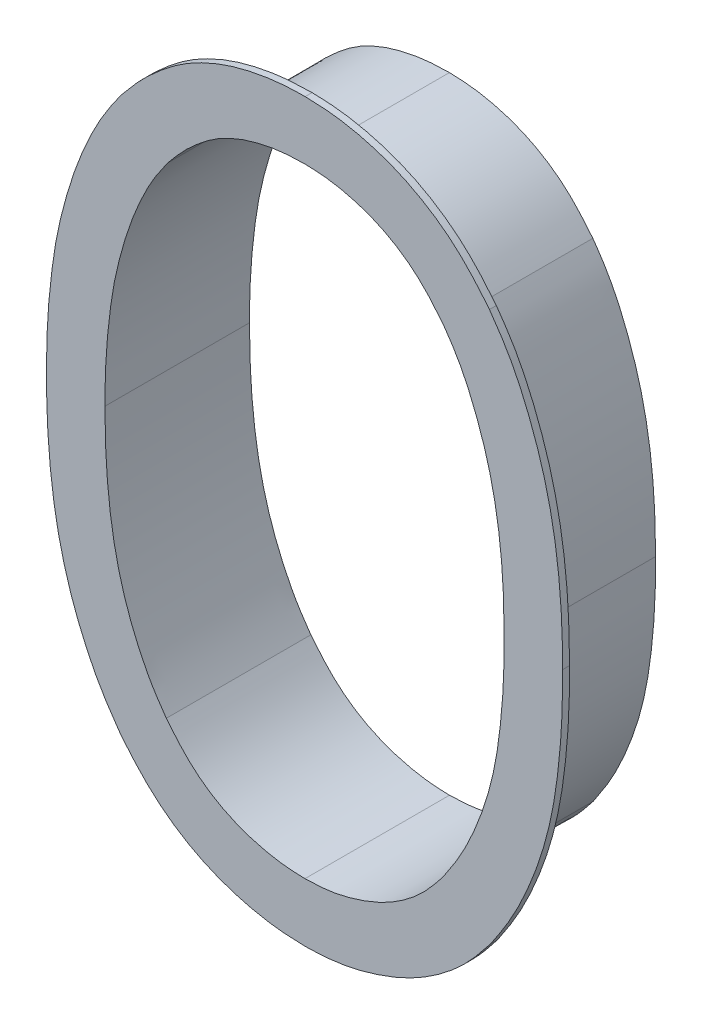
from build123d import *

# Parameters (mm, degrees)
BOSS_EXTRUDE1_DEPTH      = 1
BOSS_EXTRUDE1_DEPTH_BACK = 20
CUT_EXTRUDE1_DEPTH       = 108.424377703
CUT_EXTRUDE2_DEPTH       = 20


with BuildPart() as part:
    # Sketch1 → Boss-Extrude1 (new, two sides: drawn at the far end of the back side and taken through both)
    with BuildSketch(Plane.XY.offset(-BOSS_EXTRUDE1_DEPTH_BACK)):
        with BuildLine():
            add(Edge.make_bspline(
                [(2867.550981787, -1534.018284524), (2866.726669934, -1533.016673289), (2865.903331775, -1532.0139593), (2864.168194025, -1530.108718015), (2863.257736558, -1529.2046707), (2861.320445794, -1527.52837712), (2860.291663886, -1526.758337746), (2858.669123788, -1525.693165779), (2858.115518951, -1525.352557641), (2856.982492704, -1524.700579838), (2856.403299251, -1524.389960753), (2853.487637686, -1522.941890219), (2851.052549882, -1522.104118603), (2847.906668653, -1521.375909526), (2847.272631369, -1521.245467432), (2845.99309967, -1521.020407923), (2845.346335825, -1520.925682909), (2844.044824104, -1520.779866571), (2843.392534449, -1520.730980323), (2842.086182938, -1520.660963629), (2841.432122831, -1520.639805771), (2840.778087094, -1520.618266243)],
                knots=[0, 0, 0, 0, 0.125, 0.125, 0.25, 0.25, 0.375, 0.375, 0.4375, 0.4375, 0.5, 0.5, 0.75, 0.75, 0.8125, 0.8125, 0.875, 0.875, 0.9375, 0.9375, 1, 1, 1, 1], degree=3))
            add(Edge.make_bspline(
                [(2840.778087094, -1520.618266243), (2839.482255968, -1520.645951624), (2838.1868012, -1520.675671132), (2835.629535588, -1520.916947524), (2834.366177794, -1521.120143515), (2831.861063883, -1521.643287414), (2830.619943166, -1521.966669503), (2828.170088197, -1522.788474802), (2826.95328033, -1523.287217046), (2824.623840035, -1524.417062084), (2823.50672353, -1525.055881742), (2821.383367513, -1526.505640089), (2820.373008789, -1527.310184348), (2818.897915882, -1528.579785494), (2818.413289391, -1529.015858292), (2817.472469362, -1529.911705886), (2817.01588517, -1530.372439334), (2815.689411795, -1531.79473794), (2814.862667017, -1532.796276469), (2814.034988655, -1533.796950032)],
                knots=[0, 0, 0, 0, 0.125, 0.125, 0.25, 0.25, 0.375, 0.375, 0.5, 0.5, 0.625, 0.625, 0.75, 0.75, 0.8125, 0.8125, 0.875, 0.875, 1, 1, 1, 1], degree=3))
            add(Edge.make_bspline(
                [(2814.034988655, -1533.796950032), (2813.520317325, -1534.522913295), (2813.004467704, -1535.248303696), (2812.017261221, -1536.720716027), (2811.548505014, -1537.469002346), (2810.672548186, -1538.995502136), (2810.264314938, -1539.773213563), (2809.488458401, -1541.348380203), (2809.119773324, -1542.145319195), (2808.417709692, -1543.756362535), (2808.084791575, -1544.570690741), (2807.457495675, -1546.218084726), (2807.16353084, -1547.051351273), (2806.609611695, -1548.734419635), (2806.349191719, -1549.585413693), (2805.857967435, -1551.293364665), (2805.626529307, -1552.150248424), (2805.19794891, -1553.871052884), (2805.000864278, -1554.734985411), (2804.64686161, -1556.471091984), (2804.490654329, -1557.343411866), (2804.211504213, -1559.094876943), (2804.088491516, -1559.974007803), (2803.86600941, -1561.737100217), (2803.765506417, -1562.620719903), (2803.498062361, -1565.271902691), (2803.368970865, -1567.04215703), (2803.22037608, -1570.588899959), (2803.196358835, -1572.365131759), (2803.171798599, -1574.14133267)],
                knots=[0, 0, 0, 0, 0.0625, 0.0625, 0.125, 0.125, 0.1875, 0.1875, 0.25, 0.25, 0.3125, 0.3125, 0.375, 0.375, 0.4375, 0.4375, 0.5, 0.5, 0.5625, 0.5625, 0.625, 0.625, 0.6875, 0.6875, 0.75, 0.75, 0.875, 0.875, 1, 1, 1, 1], degree=3))
            add(Edge.make_bspline(
                [(2803.171798599, -1574.14133267), (2803.197934131, -1575.899407851), (2803.223572787, -1577.65750617), (2803.357597853, -1581.169849407), (2803.469175861, -1582.923945698), (2803.793967227, -1586.427405318), (2804.003018201, -1588.173719502), (2804.539970007, -1591.643522555), (2804.871311526, -1593.367599376), (2805.482598261, -1595.934037916), (2805.705297725, -1596.787500719), (2806.186026682, -1598.475210537), (2806.444191453, -1599.310810006), (2807.274630372, -1601.791662365), (2807.903846315, -1603.410506726), (2808.955506963, -1605.788760629), (2809.323084957, -1606.573616314), (2810.0953485, -1608.126117903), (2810.501002081, -1608.893314851), (2811.367913517, -1610.401920536), (2811.830399625, -1611.142759633), (2812.799615219, -1612.603918584), (2813.30425055, -1613.325209668), (2813.807793783, -1614.047007246)],
                knots=[0, 0, 0, 0, 0.125, 0.125, 0.25, 0.25, 0.375, 0.375, 0.5, 0.5, 0.5625, 0.5625, 0.625, 0.625, 0.75, 0.75, 0.8125, 0.8125, 0.875, 0.875, 0.9375, 0.9375, 1, 1, 1, 1], degree=3))
            add(Edge.make_bspline(
                [(2813.807793783, -1614.047007246), (2814.630107586, -1615.060598361), (2815.451797544, -1616.074881166), (2817.193311878, -1617.994639735), (2818.111859469, -1618.901531141), (2820.057855984, -1620.594569036), (2821.085444677, -1621.380560556), (2822.713994838, -1622.462900841), (2823.271513745, -1622.807416769), (2824.416380943, -1623.463375142), (2824.997804789, -1623.771457012), (2827.93317208, -1625.211940528), (2830.384739981, -1626.057858686), (2833.558170713, -1626.791882356), (2834.198241918, -1626.92270678), (2835.490692674, -1627.147830269), (2836.144438676, -1627.242055541), (2838.106631395, -1627.458474363), (2839.422001459, -1627.503974116), (2840.737467236, -1627.548168289)],
                knots=[0, 0, 0, 0, 0.125, 0.125, 0.25, 0.25, 0.375, 0.375, 0.4375, 0.4375, 0.5, 0.5, 0.75, 0.75, 0.8125, 0.8125, 0.875, 0.875, 1, 1, 1, 1], degree=3))
            add(Edge.make_bspline(
                [(2840.737467236, -1627.548168289), (2842.053831936, -1627.505174832), (2843.369874247, -1627.460476657), (2845.965273107, -1627.177093927), (2847.246722599, -1626.94947641), (2849.779317361, -1626.333999207), (2851.030643196, -1625.94709431), (2852.891082107, -1625.279224985), (2853.509056231, -1625.04019579), (2854.721073405, -1624.528538908), (2855.316771428, -1624.255167215), (2857.06986008, -1623.377192491), (2858.194948661, -1622.717628071), (2859.823640933, -1621.627994999), (2860.356496438, -1621.247697818), (2861.400636286, -1620.450400488), (2861.913480342, -1620.032005189), (2863.405008085, -1618.728971089), (2864.334686324, -1617.800593701), (2866.080306192, -1615.838870115), (2866.894028662, -1614.803475831), (2867.70846268, -1613.768738243)],
                knots=[0, 0, 0, 0, 0.125, 0.125, 0.25, 0.25, 0.375, 0.375, 0.4375, 0.4375, 0.5, 0.5, 0.625, 0.625, 0.6875, 0.6875, 0.75, 0.75, 0.875, 0.875, 1, 1, 1, 1], degree=3))
            add(Edge.make_bspline(
                [(2867.70846268, -1613.768738243), (2868.19603201, -1613.042916084), (2868.684608264, -1612.317570902), (2869.630535197, -1610.852089056), (2870.08657658, -1610.111332181), (2871.380286345, -1607.85381163), (2872.151008848, -1606.305335844), (2873.551584263, -1603.141654667), (2874.181498961, -1601.526478544), (2875.020043732, -1599.053347371), (2875.281521558, -1598.220426181), (2875.766103566, -1596.536406293), (2875.988460291, -1595.688586801), (2876.593986087, -1593.136972092), (2876.91327239, -1591.420591919), (2877.296991004, -1588.828757202), (2877.409250484, -1587.961975095), (2877.612246279, -1586.224508116), (2877.703460689, -1585.353503518), (2877.942170175, -1582.73991052), (2878.051704983, -1580.995234174), (2878.169545277, -1577.501226585), (2878.183829611, -1575.75217027), (2878.198200329, -1574.003117928)],
                knots=[0, 0, 0, 0, 0.0625, 0.0625, 0.125, 0.125, 0.25, 0.25, 0.375, 0.375, 0.4375, 0.4375, 0.5, 0.5, 0.625, 0.625, 0.6875, 0.6875, 0.75, 0.75, 0.875, 0.875, 1, 1, 1, 1], degree=3))
            add(Edge.make_bspline(
                [(2878.198200329, -1574.003117928), (2878.170715802, -1572.244237268), (2878.143547605, -1570.485341057), (2878.003838155, -1566.971745669), (2877.888768483, -1565.217170791), (2877.550156687, -1561.71335366), (2877.329355407, -1559.967208823), (2876.765535621, -1556.500208882), (2876.42251932, -1554.777786009), (2875.801117381, -1552.213525973), (2875.575568387, -1551.36054037), (2875.088850149, -1549.672231532), (2874.827850731, -1548.836195784), (2873.996945227, -1546.350137102), (2873.383410059, -1544.720193768), (2872.362745994, -1542.32146849), (2872.005403179, -1541.529773281), (2871.248665231, -1539.965736783), (2870.848899607, -1539.193566007), (2869.989667524, -1537.676700828), (2869.529224121, -1536.932456049), (2868.560883456, -1535.465806386), (2868.055278555, -1534.742346479), (2867.550981787, -1534.018284524)],
                knots=[0, 0, 0, 0, 0.125, 0.125, 0.25, 0.25, 0.375, 0.375, 0.5, 0.5, 0.5625, 0.5625, 0.625, 0.625, 0.75, 0.75, 0.8125, 0.8125, 0.875, 0.875, 0.9375, 0.9375, 1, 1, 1, 1], degree=3))
        make_face()
        with BuildLine():
            add(Edge.make_bspline(
                [(2859.574553128, -1540.062940936), (2858.993973603, -1539.35769697), (2858.412814815, -1538.653082859), (2857.199664795, -1537.299126654), (2856.565713378, -1536.651915944), (2855.209563162, -1535.453449205), (2854.482953317, -1534.906989471), (2853.333000755, -1534.15258121), (2852.938780538, -1533.91053846), (2852.138617279, -1533.451303508), (2851.733896878, -1533.235081312), (2849.685902634, -1532.224407254), (2847.967033012, -1531.648251657), (2845.744514013, -1531.141548888), (2845.296503127, -1531.05033567), (2844.391641825, -1530.893434948), (2843.934059007, -1530.827605141), (2842.560890903, -1530.681935091), (2841.640541252, -1530.652266412), (2840.720250162, -1530.621792388)],
                knots=[0, 0, 0, 0, 0.125, 0.125, 0.25, 0.25, 0.375, 0.375, 0.4375, 0.4375, 0.5, 0.5, 0.75, 0.75, 0.8125, 0.8125, 0.875, 0.875, 1, 1, 1, 1], degree=3))
            add(Edge.make_bspline(
                [(2840.720250162, -1530.621792388), (2839.810255808, -1530.641382444), (2838.900203622, -1530.660673023), (2837.10258928, -1530.815718028), (2836.215837572, -1530.955669325), (2834.457082641, -1531.311946452), (2833.585089034, -1531.528322067), (2832.295639861, -1531.948900657), (2831.868898935, -1532.105019705), (2831.021207461, -1532.447243081), (2830.599030673, -1532.634113507), (2829.775360222, -1533.031703953), (2829.372546183, -1533.24353081), (2828.589799786, -1533.700238459), (2828.210645346, -1533.946242997), (2827.473647464, -1534.469037065), (2827.115016725, -1534.744689296), (2826.40916489, -1535.31247566), (2826.061836005, -1535.604454084), (2825.377157185, -1536.202826112), (2825.039766011, -1536.510623027), (2824.383065021, -1537.145269228), (2824.064922977, -1537.471814456), (2823.140810811, -1538.478835222), (2822.559117296, -1539.181241801), (2821.977732858, -1539.883927596)],
                knots=[0, 0, 0, 0, 0.125, 0.125, 0.25, 0.25, 0.375, 0.375, 0.4375, 0.4375, 0.5, 0.5, 0.5625, 0.5625, 0.625, 0.625, 0.6875, 0.6875, 0.75, 0.75, 0.8125, 0.8125, 0.875, 0.875, 1, 1, 1, 1], degree=3))
            add(Edge.make_bspline(
                [(2821.977732858, -1539.883927596), (2821.541843818, -1540.498918683), (2821.10622274, -1541.114038435), (2820.279054967, -1542.365440741), (2819.891380357, -1543.003582519), (2819.175801033, -1544.30856525), (2818.84354984, -1544.973319194), (2818.209036872, -1546.31722683), (2817.907465724, -1546.996712135), (2817.336287893, -1548.371030837), (2817.067105022, -1549.066067731), (2816.562474739, -1550.472339971), (2816.326437263, -1551.183291992), (2815.880474184, -1552.617733938), (2815.670350573, -1553.340649048), (2815.274082236, -1554.789032707), (2815.088547339, -1555.515772098), (2814.748569104, -1556.975537566), (2814.594506125, -1557.70864055), (2814.321649462, -1559.18197794), (2814.081780196, -1560.661985352), (2813.890164814, -1562.151749656), (2813.714163149, -1563.64467104), (2813.634352563, -1564.391967369), (2813.424587113, -1566.634947671), (2813.325965852, -1568.1325335), (2813.214449312, -1571.132416753), (2813.193601034, -1572.634277072), (2813.172826438, -1574.136141441)],
                knots=[0, 0, 0, 0, 0.0625, 0.0625, 0.125, 0.125, 0.1875, 0.1875, 0.25, 0.25, 0.3125, 0.3125, 0.375, 0.375, 0.4375, 0.4375, 0.5, 0.5, 0.5625, 0.5625, 0.625, 0.6875, 0.6875, 0.75, 0.75, 0.875, 0.875, 1, 1, 1, 1], degree=3))
            add(Edge.make_bspline(
                [(2813.172826438, -1574.136141441), (2813.194932222, -1575.622756268), (2813.217146935, -1577.109365501), (2813.317988434, -1580.079686736), (2813.401469918, -1581.563149409), (2813.650895469, -1584.525839614), (2813.813436549, -1586.006816649), (2814.228177418, -1588.94948324), (2814.482889481, -1590.411981264), (2814.960157592, -1592.587961318), (2815.134954256, -1593.310356583), (2815.516908322, -1594.749107695), (2815.724129635, -1595.46490305), (2816.39214344, -1597.585935451), (2816.902703092, -1598.969239288), (2817.765120387, -1600.998706148), (2818.06810101, -1601.667890624), (2818.704069095, -1602.992126124), (2819.036900528, -1603.647250638), (2819.750693048, -1604.93483023), (2820.135709718, -1605.565375096), (2820.949706714, -1606.805757607), (2821.375612616, -1607.41704333), (2821.801858867, -1608.028168746)],
                knots=[0, 0, 0, 0, 0.125, 0.125, 0.25, 0.25, 0.375, 0.375, 0.5, 0.5, 0.5625, 0.5625, 0.625, 0.625, 0.75, 0.75, 0.8125, 0.8125, 0.875, 0.875, 0.9375, 0.9375, 1, 1, 1, 1], degree=3))
            add(Edge.make_bspline(
                [(2821.801858867, -1608.028168746), (2822.380015859, -1608.740599488), (2822.958626366, -1609.452524843), (2824.171563392, -1610.814287142), (2824.809658751, -1611.45992419), (2826.164545462, -1612.663501604), (2826.881620149, -1613.221126228), (2828.021919007, -1613.985477917), (2828.41292353, -1614.228109683), (2829.21696937, -1614.68881601), (2829.629955809, -1614.906766856), (2831.707857118, -1615.919148107), (2833.441791601, -1616.504714795), (2835.679191962, -1617.017444714), (2836.130139727, -1617.109127704), (2837.040279431, -1617.266667747), (2837.500833335, -1617.332601713), (2838.886112708, -1617.480271737), (2839.814121108, -1617.5112819), (2840.742104447, -1617.542668551)],
                knots=[0, 0, 0, 0, 0.125, 0.125, 0.25, 0.25, 0.375, 0.375, 0.4375, 0.4375, 0.5, 0.5, 0.75, 0.75, 0.8125, 0.8125, 0.875, 0.875, 1, 1, 1, 1], degree=3))
            add(Edge.make_bspline(
                [(2840.742104447, -1617.542668551), (2841.665163478, -1617.512286254), (2842.588221518, -1617.48189938), (2844.406368353, -1617.291971524), (2845.301490569, -1617.132584866), (2847.067206857, -1616.700547482), (2847.938127548, -1616.429404989), (2849.232863902, -1615.968919378), (2849.662345426, -1615.805739611), (2850.515413843, -1615.452160334), (2850.939729401, -1615.260972241), (2852.179240699, -1614.646559377), (2852.969268023, -1614.182658688), (2854.489094792, -1613.164811044), (2855.217685933, -1612.609057563), (2856.255355411, -1611.692872455), (2856.593055696, -1611.373199985), (2857.244583555, -1610.71523313), (2857.559034121, -1610.376369017), (2858.472358241, -1609.333551667), (2859.045151851, -1608.606821143), (2859.617590162, -1607.879780313)],
                knots=[0, 0, 0, 0, 0.125, 0.125, 0.25, 0.25, 0.375, 0.375, 0.4375, 0.4375, 0.5, 0.5, 0.625, 0.625, 0.75, 0.75, 0.8125, 0.8125, 0.875, 0.875, 1, 1, 1, 1], degree=3))
            add(Edge.make_bspline(
                [(2859.617590162, -1607.879780313), (2860.032108516, -1607.262609766), (2860.446226134, -1606.645220076), (2861.247207391, -1605.395536852), (2861.632448464, -1604.762356017), (2862.718960047, -1602.824965113), (2863.363261718, -1601.489601622), (2864.240659829, -1599.437856968), (2864.517678934, -1598.745519498), (2865.036627429, -1597.355971153), (2865.279460431, -1596.657351352), (2865.95680084, -1594.549669697), (2866.338635169, -1593.128435612), (2866.963411105, -1590.253870692), (2867.205988505, -1588.800455694), (2867.500889971, -1586.604396145), (2867.588455367, -1585.86989552), (2867.748218894, -1584.397343047), (2867.819777122, -1583.658780185), (2867.943429043, -1582.181759494), (2867.995698388, -1581.442845716), (2868.078076069, -1579.964082636), (2868.108042819, -1579.224227356), (2868.173164379, -1577.003615487), (2868.185378838, -1575.521890472), (2868.197558346, -1574.040163982)],
                knots=[0, 0, 0, 0, 0.0625, 0.0625, 0.125, 0.125, 0.25, 0.25, 0.3125, 0.3125, 0.375, 0.375, 0.5, 0.5, 0.625, 0.625, 0.6875, 0.6875, 0.75, 0.75, 0.8125, 0.8125, 0.875, 0.875, 1, 1, 1, 1], degree=3))
            add(Edge.make_bspline(
                [(2868.197558346, -1574.040163982), (2868.174311517, -1572.55277636), (2868.151009075, -1571.065391754), (2868.046140063, -1568.093783839), (2867.960127934, -1566.609801736), (2867.700732914, -1563.646578094), (2867.529713551, -1562.165260019), (2867.091203073, -1559.224105494), (2866.823211889, -1557.763134341), (2866.334438851, -1555.588783635), (2866.157036899, -1554.866853678), (2865.770187357, -1553.429310126), (2865.560098603, -1552.713298121), (2864.887689844, -1550.588955681), (2864.38578241, -1549.197691754), (2863.554190509, -1547.147441072), (2863.262978423, -1546.470547358), (2862.646713212, -1545.132511232), (2862.322049888, -1544.471187388), (2861.620798969, -1543.172707841), (2861.239858649, -1542.537578113), (2860.428647167, -1541.290279686), (2860.001785165, -1540.676524195), (2859.574553128, -1540.062940936)],
                knots=[0, 0, 0, 0, 0.125, 0.125, 0.25, 0.25, 0.375, 0.375, 0.5, 0.5, 0.5625, 0.5625, 0.625, 0.625, 0.75, 0.75, 0.8125, 0.8125, 0.875, 0.875, 0.9375, 0.9375, 1, 1, 1, 1], degree=3))
        make_face(mode=Mode.SUBTRACT)
    extrude(amount=BOSS_EXTRUDE1_DEPTH + BOSS_EXTRUDE1_DEPTH_BACK)

    # 3DSketch1 → Cut-Extrude1 (cut, through all)
    with BuildSketch(Plane(origin=(2840.741406949, -1619.043473492, 1), x_dir=(-0.0461916012688002, 0.9989325983129314, 0), z_dir=(0, 0, -1))):
        with BuildLine():
            add(Edge.make_bspline(
                [(0, -5e-09), (-0.001345106, 0.10190014), (-0.002657074, 0.203801036), (-0.003915915, 0.305703135), (-0.008368011, 0.688326224), (-0.011507472, 1.070979031), (-0.012205821, 1.351728705), (-0.007788088, 2.038844699), (0.017006197, 2.725922427), (0.039910499, 3.131891147), (0.107873315, 3.985635097), (0.222301119, 4.83451917), (0.294270941, 5.278850982), (0.473363235, 6.235124708), (0.698800126, 7.181159521), (0.832132158, 7.686567229), (1.138565292, 8.753342361), (1.489258441, 9.807007), (1.689466575, 10.359114555), (2.119607524, 11.438838675), (2.625568461, 12.485581429), (2.893243748, 12.995362465), (3.426328748, 13.937556921), (4.010813739, 14.848435331), (4.295894627, 15.267134464), (4.855230254, 16.040213538), (5.457100954, 16.780449838), (5.74851989, 17.120459113), (6.330365256, 17.765343428), (6.942625044, 18.381028413), (7.245280153, 18.673353694), (7.768120952, 19.161657527), (8.301742545, 19.637679645), (8.522843857, 19.832186427), (8.819470967, 20.090818872), (9.116758651, 20.348686768), (9.191628069, 20.413561047), (9.266522396, 20.478406498), (9.341433154, 20.54323293)],
                knots=[0, 0, 0, 0, 0, 0, 0.021728615, 0.021728615, 0.021728615, 0.08158551, 0.08158551, 0.08158551, 0.16822379, 0.16822379, 0.16822379, 0.264114247, 0.264114247, 0.264114247, 0.3754856, 0.3754856, 0.3754856, 0.500556438, 0.500556438, 0.500556438, 0.623143203, 0.623143203, 0.623143203, 0.73101359, 0.73101359, 0.73101359, 0.826417036, 0.826417036, 0.826417036, 0.916090355, 0.916090355, 0.916090355, 0.97887748, 0.97887748, 0.97887748, 1, 1, 1, 1, 1, 1], degree=5))
            add(Edge.make_bspline(
                [(9.341433154, 20.54323293), (9.494398294, 20.656520364), (9.647408568, 20.769751153), (9.800508674, 20.882869194), (10.336897919, 21.278241486), (10.875483322, 21.6708574), (11.262443514, 21.948182384), (12.238100316, 22.629276947), (13.241682793, 23.269290821), (13.852820276, 23.639059115), (15.07630468, 24.342800993), (16.327187504, 24.995596144), (16.95113513, 25.306132267), (18.223922616, 25.911056413), (19.516825124, 26.471648451), (20.175290455, 26.743320666), (21.501060201, 27.262305587), (22.845291914, 27.731798114), (23.521358654, 27.953754818), (24.8971269, 28.376531973), (26.288319454, 28.745078743), (26.995155321, 28.918435774), (28.432372999, 29.244957417), (29.878890006, 29.525294094), (30.613086367, 29.657111529), (32.097451434, 29.906216002), (33.586022202, 30.12838231), (34.337903222, 30.232768389), (35.865096218, 30.427274644), (37.396742401, 30.583501657), (38.17414141, 30.653819038), (39.475811377, 30.758189401), (40.778696378, 30.84303498), (41.302929774, 30.874795476), (42.081556052, 30.919615928), (42.860272002, 30.962698523), (43.11460814, 30.976641212), (43.368947937, 30.990513002), (43.623288438, 31.004371129)],
                knots=[0, 0, 0, 0, 0, 0, 0.026101593, 0.026101593, 0.026101593, 0.091367159, 0.091367159, 0.091367159, 0.18924439, 0.18924439, 0.18924439, 0.28477456, 0.28477456, 0.28477456, 0.382410698, 0.382410698, 0.382410698, 0.479936748, 0.479936748, 0.479936748, 0.579690493, 0.579690493, 0.579690493, 0.681959479, 0.681959479, 0.681959479, 0.786036494, 0.786036494, 0.786036494, 0.893054132, 0.893054132, 0.893054132, 0.965071356, 0.965071356, 0.965071356, 1, 1, 1, 1, 1, 1], degree=5))
            add(Edge.make_bspline(
                [(43.623288438, 31.004371129), (43.940947488, 31.014086529), (44.258607375, 31.023781173), (44.576272369, 31.033346558), (45.551355437, 31.061977163), (46.526567375, 31.087345472), (47.184128545, 31.101605809), (48.822723962, 31.12666406), (50.461813853, 31.117180739), (51.442943406, 31.098094429), (53.365705963, 31.032365238), (55.285628919, 30.907176822), (56.225253096, 30.830892668), (57.984051369, 30.65860228), (59.736560695, 30.429044775), (60.552359755, 30.308532893), (62.062273486, 30.058202067), (63.562384096, 29.755180797), (64.251987828, 29.604180383), (65.529164693, 29.302557948), (66.796473381, 28.962012562), (67.379899495, 28.796633832), (68.539948623, 28.451112904), (69.690661636, 28.076007941), (70.262416176, 27.881341787), (71.370368254, 27.487590152), (72.467813328, 27.064619339), (72.998164133, 26.850454323), (74.0598988, 26.398034663), (75.100820006, 25.89847638), (75.619937541, 25.634216465), (76.46947651, 25.175380217), (77.298642782, 24.681520811), (77.625351455, 24.481580868), (78.071243409, 24.204184464), (78.516029909, 23.925201026), (78.636312925, 23.849626555), (78.756551458, 23.773988221), (78.876763728, 23.698312185)],
                knots=[0, 0, 0, 0, 0, 0, 0.043429363, 0.043429363, 0.043429363, 0.133303907, 0.133303907, 0.133303907, 0.267365567, 0.267365567, 0.267365567, 0.396146522, 0.396146522, 0.396146522, 0.508783998, 0.508783998, 0.508783998, 0.605223573, 0.605223573, 0.605223573, 0.688070037, 0.688070037, 0.688070037, 0.770592322, 0.770592322, 0.770592322, 0.848719679, 0.848719679, 0.848719679, 0.92825835, 0.92825835, 0.92825835, 0.980588888, 0.980588888, 0.980588888, 1, 1, 1, 1, 1, 1], degree=5))
            add(Edge.make_bspline(
                [(78.876763728, 23.698312185), (78.952748736, 23.641418158), (79.028721499, 23.584507702), (79.104676313, 23.527573216), (79.419115249, 23.291670526), (79.73305134, 23.055094661), (79.97052381, 22.874781433), (80.539844722, 22.437395339), (81.101148115, 21.989437817), (81.425601401, 21.722931616), (82.079428117, 21.166552734), (82.709435692, 20.582725512), (83.024060571, 20.276711459), (83.676888684, 19.606882873), (84.286875548, 18.897261523), (84.599219644, 18.5106447), (85.240813286, 17.669536831), (85.835849016, 16.795421612), (86.13755568, 16.323027914), (86.720696756, 15.346535317), (87.241856464, 14.335233706), (87.490163399, 13.81407847), (87.930674538, 12.811145624), (88.312371426, 11.784967845), (88.480696692, 11.294994481), (88.775440837, 10.367927087), (89.033377368, 9.430090197), (89.144790876, 8.989384485), (89.337549441, 8.145129802), (89.489040323, 7.292377434), (89.552108874, 6.885578206), (89.643449337, 6.202332245), (89.711993593, 5.516755023), (89.736929997, 5.240299348), (89.769398232, 4.854546725), (89.800636066, 4.468727613), (89.809399351, 4.359556688), (89.818110332, 4.250382937), (89.826792107, 4.141207607)],
                knots=[0, 0, 0, 0, 0, 0, 0.02039408, 0.02039408, 0.02039408, 0.084454016, 0.084454016, 0.084454016, 0.174634038, 0.174634038, 0.174634038, 0.268859216, 0.268859216, 0.268859216, 0.375481837, 0.375481837, 0.375481837, 0.495777603, 0.495777603, 0.495777603, 0.619637421, 0.619637421, 0.619637421, 0.730851138, 0.730851138, 0.730851138, 0.828455315, 0.828455315, 0.828455315, 0.916840879, 0.916840879, 0.916840879, 0.976470271, 0.976470271, 0.976470271, 1, 1, 1, 1, 1, 1], degree=5))
            add(Edge.make_bspline(
                [(89.826792107, 4.141207607), (89.829500311, 4.031203294), (89.832178071, 3.921197768), (89.83480119, 3.811190081), (89.843741022, 3.424645392), (89.851408779, 3.03805042), (89.855359304, 2.761456063), (89.859160078, 2.075008739), (89.842621085, 1.388425775), (89.824807, 0.978766402), (89.769741522, 0.126852584), (89.674264722, -0.721372675), (89.614801166, -1.161172519), (89.468075315, -2.104551974), (89.285845925, -3.042047435), (89.176486106, -3.541136692), (88.920881739, -4.572058783), (88.599354436, -5.584826533), (88.415070031, -6.105014923), (88.010787797, -7.137402748), (87.53965053, -8.141728043), (87.285271134, -8.637268965), (86.765377528, -9.560579405), (86.174440776, -10.439151199), (85.881379017, -10.848061108), (85.304466862, -11.616966169), (84.707535596, -12.369635236), (84.417200968, -12.72316977), (83.84389559, -13.391683246), (83.238166624, -14.031295619), (82.940653823, -14.332918765), (82.431117755, -14.832226321), (81.91052722, -15.319367626), (81.697778972, -15.51573405), (81.412111953, -15.777129138), (81.125813015, -16.037842446), (81.053545944, -16.1035874), (80.981254924, -16.169306516), (80.908948097, -16.235008577)],
                knots=[0, 0, 0, 0, 0, 0, 0.023776889, 0.023776889, 0.023776889, 0.083544799, 0.083544799, 0.083544799, 0.17209543, 0.17209543, 0.17209543, 0.267939707, 0.267939707, 0.267939707, 0.378236477, 0.378236477, 0.378236477, 0.497313658, 0.497313658, 0.497313658, 0.617443893, 0.617443893, 0.617443893, 0.726031371, 0.726031371, 0.726031371, 0.824839182, 0.824839182, 0.824839182, 0.916328504, 0.916328504, 0.916328504, 0.978889166, 0.978889166, 0.978889166, 1, 1, 1, 1, 1, 1], degree=5))
            add(Edge.make_bspline(
                [(80.908948097, -16.235008577), (80.763591797, -16.348415069), (80.618170289, -16.461747405), (80.472620184, -16.574933492), (79.956058849, -16.975330997), (79.436289337, -17.372079973), (79.060020337, -17.652631562), (78.103528492, -18.340449588), (77.108360622, -18.971412554), (76.498179405, -19.333496799), (75.265976273, -20.025356426), (74.010128801, -20.671051305), (73.379229402, -20.980715676), (72.078564154, -21.588792916), (70.754780263, -22.145145617), (70.073660247, -22.416913955), (68.700122468, -22.939176196), (67.312420196, -23.421497973), (66.613796046, -23.652818728), (65.196583516, -24.098482357), (63.76589415, -24.500000753), (63.040616315, -24.690621043), (61.574805359, -25.048519557), (60.096972381, -25.351606479), (59.351142327, -25.492661213), (57.846782295, -25.758476563), (56.338245399, -25.99790015), (55.57820747, -26.110751537), (54.032629891, -26.322590489), (52.482060565, -26.495506267), (51.694105165, -26.573934082), (50.376841204, -26.690502319), (49.058030019, -26.784950677), (48.528718042, -26.820197356), (47.745634442, -26.869765689), (46.962452546, -26.917536517), (46.708754881, -26.932879336), (46.455053176, -26.948148279), (46.201350569, -26.963400707)],
                knots=[0, 0, 0, 0, 0, 0, 0.024958548, 0.024958548, 0.024958548, 0.08846189, 0.08846189, 0.08846189, 0.184420242, 0.184420242, 0.184420242, 0.279533875, 0.279533875, 0.279533875, 0.378768207, 0.378768207, 0.378768207, 0.478375414, 0.478375414, 0.478375414, 0.579853489, 0.579853489, 0.579853489, 0.682586654, 0.682586654, 0.682586654, 0.786597423, 0.786597423, 0.786597423, 0.893775882, 0.893775882, 0.893775882, 0.965591584, 0.965591584, 0.965591584, 1, 1, 1, 1, 1, 1], degree=5))
            add(Edge.make_bspline(
                [(46.201350569, -26.963400707), (45.887501459, -26.973237442), (45.573651362, -26.983051636), (45.259796099, -26.992746555), (44.287060456, -27.02212379), (43.314194688, -27.048497082), (42.655170777, -27.063588865), (41.02016614, -27.090693437), (39.384700882, -27.0835876), (38.408599999, -27.066652945), (36.489794613, -27.007397658), (34.573244261, -26.895151911), (33.632232184, -26.825913707), (31.831937351, -26.663869913), (30.037754286, -26.440832204), (29.182087387, -26.319115741), (27.556720635, -26.05622738), (25.942843049, -25.730080431), (25.179089133, -25.560496608), (23.725313014, -25.207600165), (22.286164604, -24.798775969), (21.603287669, -24.591038598), (20.265010082, -24.156504242), (18.943973964, -23.67283823), (18.297368984, -23.422693068), (17.000877424, -22.893987769), (15.72365677, -22.318141447), (15.085869667, -22.01286246), (14.039189062, -21.476118686), (13.022801163, -20.884522005), (12.62072251, -20.641928948), (12.062107164, -20.297030704), (11.506018788, -19.948563499), (11.347883684, -19.84915689), (11.189850685, -19.749606074), (11.031868471, -19.649983531)],
                knots=[0, 0, 0, 0, 0, 0, 0.042970744, 0.042970744, 0.042970744, 0.133175809, 0.133175809, 0.133175809, 0.266741198, 0.266741198, 0.266741198, 0.395826664, 0.395826664, 0.395826664, 0.514040191, 0.514040191, 0.514040191, 0.621054984, 0.621054984, 0.621054984, 0.718684913, 0.718684913, 0.718684913, 0.813532929, 0.813532929, 0.813532929, 0.910208938, 0.910208938, 0.910208938, 0.974441302, 0.974441302, 0.974441302, 1, 1, 1, 1, 1, 1], degree=5))
            add(Edge.make_bspline(
                [(11.031868471, -19.649983531), (10.950475165, -19.589929604), (10.869095928, -19.529856657), (10.787738487, -19.469754297), (10.469216427, -19.234206597), (10.151265135, -18.997888639), (9.915207105, -18.820953579), (9.345390123, -18.388241975), (8.784396716, -17.943686948), (8.458780993, -17.677398887), (7.800394145, -17.118150646), (7.167725739, -16.529671823), (6.850280996, -16.220018876), (6.191335209, -15.545105609), (5.568951341, -14.835663613), (5.250083289, -14.450342337), (4.595852107, -13.610596114), (3.996851965, -12.730649134), (3.694626137, -12.253769462), (3.113243363, -11.268844258), (2.59397577, -10.250084698), (2.346826432, -9.726325327), (1.905732938, -8.714782146), (1.521262041, -7.680815939), (1.350675203, -7.184940264), (1.052728861, -6.249053777), (0.79288513, -5.30195371), (0.681178258, -4.858126098), (0.488056085, -4.006485981), (0.337350305, -3.146254365), (0.274591954, -2.735180065), (0.183339212, -2.04366211), (0.113844773, -1.349966173), (0.088366017, -1.06955745), (0.05587038, -0.68734479), (0.024608357, -0.305056027), (0.016362034, -0.20337337), (0.008165495, -0.101687643), (0, -5e-09)],
                knots=[0, 0, 0, 0, 0, 0, 0.021604331, 0.021604331, 0.021604331, 0.084613677, 0.084613677, 0.084613677, 0.174417374, 0.174417374, 0.174417374, 0.269072098, 0.269072098, 0.269072098, 0.37574855, 0.37574855, 0.37574855, 0.496166617, 0.496166617, 0.496166617, 0.619715586, 0.619715586, 0.619715586, 0.731627784, 0.731627784, 0.731627784, 0.829317547, 0.829317547, 0.829317547, 0.918078481, 0.918078481, 0.918078481, 0.978211101, 0.978211101, 0.978211101, 1, 1, 1, 1, 1, 1], degree=5))
        make_face()
    extrude(amount=CUT_EXTRUDE1_DEPTH, mode=Mode.SUBTRACT)

    # Sketch2 → Cut-Extrude2 (cut)
    with BuildSketch(Plane(origin=(0, 0, -20), x_dir=(-1, 0, 0), z_dir=(0, 0, -1))):
        with BuildLine():
            add(Edge.make_bspline(
                [(-2868.747447798, -1533.111590253), (-2869.262745246, -1533.851446825), (-2869.779612419, -1534.590550797), (-2870.77071914, -1536.089196419), (-2871.242735031, -1536.849804193), (-2872.125732395, -1538.400282497), (-2872.537169602, -1539.189934525), (-2873.316142432, -1540.790287055), (-2873.684135196, -1541.600768381), (-2874.735358853, -1544.0575054), (-2875.367655547, -1545.728181329), (-2876.224279962, -1548.278218325), (-2876.494076116, -1549.137310337), (-2876.995618825, -1550.866207206), (-2877.226791595, -1551.734620738), (-2877.865573449, -1554.350935363), (-2878.218956678, -1556.109807186), (-2878.800567135, -1559.652871827), (-2879.028830386, -1561.439742968), (-2879.378388782, -1565.019042591), (-2879.497567993, -1566.811730326), (-2879.642483285, -1570.402211429), (-2879.670206043, -1572.199896246), (-2879.698296616, -1573.997560967)],
                knots=[0, 0, 0, 0, 0.0625, 0.0625, 0.125, 0.125, 0.1875, 0.1875, 0.25, 0.25, 0.375, 0.375, 0.4375, 0.4375, 0.5, 0.5, 0.625, 0.625, 0.75, 0.75, 0.875, 0.875, 1, 1, 1, 1], degree=3))
            add(Edge.make_bspline(
                [(-2879.698296616, -1573.997560967), (-2879.68357806, -1575.788948425), (-2879.669086617, -1577.580345131), (-2879.545612984, -1581.159291027), (-2879.431502683, -1582.946631408), (-2879.183868739, -1585.624528303), (-2879.089543504, -1586.515499397), (-2878.879405704, -1588.293844484), (-2878.762938345, -1589.181213402), (-2878.364132177, -1591.835502742), (-2878.031983118, -1593.594541482), (-2877.193344371, -1597.085032323), (-2876.694178139, -1598.798122359), (-2875.548659174, -1602.153883068), (-2874.903765662, -1603.799132419), (-2873.470060025, -1607.024527188), (-2872.680947974, -1608.60453693), (-2871.356249073, -1610.910753952), (-2870.889508304, -1611.668104877), (-2869.921252132, -1613.167075856), (-2869.42105903, -1613.909294074), (-2868.922100522, -1614.65207078)],
                knots=[0, 0, 0, 0, 0.125, 0.125, 0.25, 0.25, 0.3125, 0.3125, 0.375, 0.375, 0.5, 0.5, 0.625, 0.625, 0.75, 0.75, 0.875, 0.875, 0.9375, 0.9375, 1, 1, 1, 1], degree=3))
            add(Edge.make_bspline(
                [(-2868.922100522, -1614.65207078), (-2868.072625307, -1615.731328174), (-2867.22374491, -1616.811237454), (-2865.411687416, -1618.845793514), (-2864.451560119, -1619.803782695), (-2862.412949525, -1621.590049803), (-2861.333673049, -1622.41745845), (-2859.629350136, -1623.564969028), (-2859.047363233, -1623.932261692), (-2857.853201781, -1624.633763123), (-2857.245112873, -1624.965344713), (-2855.403266738, -1625.892573702), (-2854.143888203, -1626.41998131), (-2851.580594499, -1627.346418629), (-2850.279116051, -1627.752472244), (-2848.285551866, -1628.242370362), (-2847.614008341, -1628.385428281), (-2846.255926692, -1628.628321826), (-2845.568062322, -1628.728207832), (-2843.504236165, -1628.956940328), (-2842.120562406, -1629.003795195), (-2840.736766305, -1629.048991012)],
                knots=[0, 0, 0, 0, 0.125, 0.125, 0.25, 0.25, 0.375, 0.375, 0.4375, 0.4375, 0.5, 0.5, 0.625, 0.625, 0.75, 0.75, 0.8125, 0.8125, 0.875, 0.875, 1, 1, 1, 1], degree=3))
            add(Edge.make_bspline(
                [(-2840.736766305, -1629.048991012), (-2839.370533268, -1629.003091271), (-2838.004772911, -1628.955020662), (-2835.316315367, -1628.661103906), (-2833.990835576, -1628.428037382), (-2831.368946824, -1627.828391194), (-2830.072738805, -1627.460888669), (-2828.153381813, -1626.79502428), (-2827.517757121, -1626.553959459), (-2826.255342181, -1626.031255993), (-2825.626112298, -1625.748350858), (-2823.776391858, -1624.847136387), (-2822.592184071, -1624.175172932), (-2820.325367596, -1622.683528713), (-2819.242198904, -1621.864662154), (-2817.175191227, -1620.082511249), (-2816.188482887, -1619.115070874), (-2814.339050151, -1617.084936906), (-2813.474395132, -1616.016914012), (-2812.608679893, -1614.949825912)],
                knots=[0, 0, 0, 0, 0.125, 0.125, 0.25, 0.25, 0.375, 0.375, 0.4375, 0.4375, 0.5, 0.5, 0.625, 0.625, 0.75, 0.75, 0.875, 0.875, 1, 1, 1, 1], degree=3))
            add(Edge.make_bspline(
                [(-2812.608679893, -1614.949825912), (-2812.093869429, -1614.211877466), (-2811.5777356, -1613.474554611), (-2810.58575071, -1611.98086614), (-2810.111928642, -1611.223541363), (-2809.222158793, -1609.681533061), (-2808.805446378, -1608.897210997), (-2808.012174238, -1607.309585601), (-2807.634595924, -1606.506763783), (-2806.553878698, -1604.07370814), (-2805.906232378, -1602.417241456), (-2805.050393092, -1599.87787989), (-2804.78419924, -1599.022403606), (-2804.288244735, -1597.294228073), (-2804.058877587, -1596.422175071), (-2803.428913339, -1593.8005656), (-2803.086548187, -1592.0387031), (-2802.531276119, -1588.491420623), (-2802.315101103, -1586.704726432), (-2801.979430393, -1583.122883097), (-2801.863686134, -1581.329396706), (-2801.724493685, -1577.73787969), (-2801.698371547, -1575.93998072), (-2801.671644439, -1574.142111535)],
                knots=[0, 0, 0, 0, 0.0625, 0.0625, 0.125, 0.125, 0.1875, 0.1875, 0.25, 0.25, 0.375, 0.375, 0.4375, 0.4375, 0.5, 0.5, 0.625, 0.625, 0.75, 0.75, 0.875, 0.875, 1, 1, 1, 1], degree=3))
            add(Edge.make_bspline(
                [(-2801.671644439, -1574.142111535), (-2801.69678227, -1572.324138809), (-2801.721261946, -1570.506133827), (-2801.875955228, -1566.87530581), (-2802.009851604, -1565.062663265), (-2802.286390841, -1562.347409192), (-2802.390031547, -1561.443883337), (-2802.619850206, -1559.641093199), (-2802.747165909, -1558.741831162), (-2803.036492858, -1556.949272304), (-2803.198614216, -1556.055994416), (-2803.565781817, -1554.276818729), (-2803.769940634, -1553.390768355), (-2804.213700184, -1551.624761148), (-2804.452697424, -1550.746741094), (-2804.957243979, -1549.005220332), (-2805.223780406, -1548.140956221), (-2805.79177801, -1546.428334769), (-2806.093351489, -1545.580028575), (-2806.736789734, -1543.901767191), (-2807.078188341, -1543.071599685), (-2807.797984247, -1541.428116033), (-2808.176012876, -1540.614631975), (-2808.972139602, -1539.005913832), (-2809.391391254, -1538.211205144), (-2810.291159076, -1536.649691202), (-2810.772314551, -1535.883177125), (-2811.785677465, -1534.373401015), (-2812.315352426, -1533.628985542), (-2812.843574556, -1532.883908366)],
                knots=[0, 0, 0, 0, 0.125, 0.125, 0.25, 0.25, 0.3125, 0.3125, 0.375, 0.375, 0.4375, 0.4375, 0.5, 0.5, 0.5625, 0.5625, 0.625, 0.625, 0.6875, 0.6875, 0.75, 0.75, 0.8125, 0.8125, 0.875, 0.875, 0.9375, 0.9375, 1, 1, 1, 1], degree=3))
            add(Edge.make_bspline(
                [(-2812.843574556, -1532.883908366), (-2813.706555322, -1531.840553752), (-2814.568642543, -1530.796259917), (-2816.406663596, -1528.827338419), (-2817.383947734, -1527.904130088), (-2819.423983807, -1526.147550129), (-2820.479222547, -1525.30628125), (-2822.729482371, -1523.770671171), (-2823.899999074, -1523.102603359), (-2826.310566251, -1521.930273583), (-2827.548775276, -1521.419626464), (-2829.457774509, -1520.772202081), (-2830.103201693, -1520.577252192), (-2831.410548182, -1520.225178739), (-2832.072903, -1520.068009124), (-2834.060392917, -1519.649207196), (-2835.392893616, -1519.434013871), (-2838.078332375, -1519.177875303), (-2839.432413315, -1519.146674203), (-2840.786759976, -1519.11773864)],
                knots=[0, 0, 0, 0, 0.125, 0.125, 0.25, 0.25, 0.375, 0.375, 0.5, 0.5, 0.625, 0.625, 0.6875, 0.6875, 0.75, 0.75, 0.875, 0.875, 1, 1, 1, 1], degree=3))
            add(Edge.make_bspline(
                [(-2840.786759976, -1519.11773864), (-2841.464928275, -1519.140072932), (-2842.821491375, -1519.183697393), (-2844.165596593, -1519.284749198), (-2846.166475328, -1519.506759232), (-2847.481660459, -1519.741124519), (-2850.084382529, -1520.337305497), (-2851.371323514, -1520.701868367), (-2853.276547068, -1521.364821934), (-2853.90742704, -1521.605142137), (-2855.16018081, -1522.127298474), (-2855.784331479, -1522.410369276), (-2857.615746672, -1523.312607731), (-2858.788891653, -1523.98417881), (-2861.048335979, -1525.454647946), (-2862.132410298, -1526.256808178), (-2864.191695373, -1528.020736757), (-2865.170170305, -1528.985316631), (-2867.012762247, -1531.000530665), (-2867.879329004, -1532.056749741), (-2868.747447798, -1533.111590253)],
                knots=[0, 0, 0, 0, 0.0625, 0.125, 0.125, 0.25, 0.25, 0.375, 0.375, 0.4375, 0.4375, 0.5, 0.5, 0.625, 0.625, 0.75, 0.75, 0.875, 0.875, 1, 1, 1, 1], degree=3))
        make_face()
        with BuildLine():
            add(Edge.make_bspline(
                [(-2861.64029588, -1609.352010548), (-2861.010039548, -1610.152210503), (-2860.379191676, -1610.951774561), (-2859.043200721, -1612.47103659), (-2858.336874632, -1613.18946285), (-2856.828083691, -1614.522967834), (-2856.026500807, -1615.138994659), (-2854.760180774, -1615.99429435), (-2854.326632271, -1616.268604732), (-2853.439662038, -1616.789369928), (-2852.99034403, -1617.033458661), (-2851.623946047, -1617.714202655), (-2850.688434943, -1618.099371561), (-2848.787349065, -1618.785728139), (-2847.821899341, -1619.087265135), (-2846.342621898, -1619.45268648), (-2845.84432088, -1619.559943832), (-2844.835283934, -1619.739722286), (-2844.324589952, -1619.811019751), (-2843.303896585, -1619.919437605), (-2842.792277476, -1619.957026529), (-2841.767354053, -1620.010192779), (-2841.254150594, -1620.027087435), (-2840.740951076, -1620.044033575)],
                knots=[0, 0, 0, 0, 0.125, 0.125, 0.25, 0.25, 0.375, 0.375, 0.4375, 0.4375, 0.5, 0.5, 0.625, 0.625, 0.75, 0.75, 0.8125, 0.8125, 0.875, 0.875, 0.9375, 0.9375, 1, 1, 1, 1], degree=3))
            add(Edge.make_bspline(
                [(-2840.740951076, -1620.044033575), (-2840.232185807, -1620.026769733), (-2839.723371171, -1620.009740268), (-2838.709759294, -1619.956608018), (-2838.205326893, -1619.918773093), (-2837.202846983, -1619.812789787), (-2836.704737531, -1619.744935496), (-2835.715280301, -1619.57712463), (-2835.223782508, -1619.477880274), (-2833.757256334, -1619.142321448), (-2832.789405046, -1618.871932404), (-2831.35551159, -1618.381443762), (-2830.880586773, -1618.203516162), (-2829.937230826, -1617.816830996), (-2829.46761174, -1617.607387727), (-2828.090795551, -1616.940199942), (-2827.209016341, -1616.441588623), (-2825.523493269, -1615.328021822), (-2824.719810678, -1614.712974989), (-2823.570132588, -1613.707143342), (-2823.19529105, -1613.357006982), (-2822.468981298, -1612.634671776), (-2822.118218277, -1612.262520834), (-2821.093588433, -1611.12155266), (-2820.448314032, -1610.327392953), (-2819.803392728, -1609.532920283)],
                knots=[0, 0, 0, 0, 0.0625, 0.0625, 0.125, 0.125, 0.1875, 0.1875, 0.25, 0.25, 0.375, 0.375, 0.4375, 0.4375, 0.5, 0.5, 0.625, 0.625, 0.75, 0.75, 0.8125, 0.8125, 0.875, 0.875, 1, 1, 1, 1], degree=3))
            add(Edge.make_bspline(
                [(-2819.803392728, -1609.532920283), (-2819.357065146, -1608.892714899), (-2818.910808138, -1608.252478529), (-2818.056341862, -1606.955300472), (-2817.652959351, -1606.296239541), (-2816.901236701, -1604.953950666), (-2816.549712053, -1604.27212092), (-2815.879761288, -1602.893929121), (-2815.561202565, -1602.19762529), (-2814.655061405, -1600.086964861), (-2814.117292242, -1598.650737149), (-2813.174357906, -1595.720060354), (-2812.769366251, -1594.225022887), (-2811.743568431, -1589.659955228), (-2811.32048985, -1586.577140384), (-2810.920991978, -1581.918720766), (-2810.828889686, -1580.364217355), (-2810.717491937, -1577.252201939), (-2810.695738681, -1575.694791497), (-2810.672569713, -1574.137439557)],
                knots=[0, 0, 0, 0, 0.0625, 0.0625, 0.125, 0.125, 0.1875, 0.1875, 0.25, 0.25, 0.375, 0.375, 0.5, 0.5, 0.75, 0.75, 0.875, 0.875, 1, 1, 1, 1], degree=3))
            add(Edge.make_bspline(
                [(-2810.672569713, -1574.137439557), (-2810.694322888, -1572.565665654), (-2810.714555877, -1570.993823075), (-2810.839688483, -1567.853962787), (-2810.94312561, -1566.285879008), (-2811.167722515, -1563.936890391), (-2811.253035429, -1563.155354652), (-2811.44035155, -1561.595125975), (-2811.54219699, -1560.816311924), (-2811.773746138, -1559.263108165), (-2811.904012352, -1558.488807792), (-2812.200961834, -1556.945990662), (-2812.366557627, -1556.177301197), (-2812.910121104, -1553.8786616), (-2813.330874026, -1552.368720175), (-2814.275023495, -1549.396955474), (-2814.802232688, -1547.935287345), (-2815.704007176, -1545.791517414), (-2816.022028761, -1545.084582468), (-2816.691743204, -1543.685500492), (-2817.043295951, -1542.993291927), (-2817.610224468, -1541.972370535), (-2817.805808193, -1541.634965341), (-2818.212770095, -1540.96709164), (-2818.424620337, -1540.636830455), (-2819.077506353, -1539.653660298), (-2819.534688018, -1539.007842357), (-2819.992109887, -1538.36212991)],
                knots=[0, 0, 0, 0, 0.125, 0.125, 0.25, 0.25, 0.3125, 0.3125, 0.375, 0.375, 0.4375, 0.4375, 0.5, 0.5, 0.625, 0.625, 0.75, 0.75, 0.8125, 0.8125, 0.875, 0.875, 0.90625, 0.90625, 0.9375, 0.9375, 1, 1, 1, 1], degree=3))
            add(Edge.make_bspline(
                [(-2819.992109887, -1538.36212991), (-2820.633178903, -1537.587555528), (-2821.274613813, -1536.813368512), (-2822.291939721, -1535.710499797), (-2822.639914931, -1535.352263866), (-2823.358135524, -1534.659369265), (-2823.727546816, -1534.32382755), (-2824.480172622, -1533.667357483), (-2824.862084165, -1533.345049687), (-2825.642438325, -1532.717935416), (-2826.041607366, -1532.413898001), (-2826.868806503, -1531.836378147), (-2827.298116092, -1531.563355272), (-2828.167476508, -1531.056752475), (-2828.609572672, -1530.821522284), (-2829.955162644, -1530.162865569), (-2830.877729047, -1529.785915153), (-2832.300902608, -1529.316314173), (-2832.781862661, -1529.17578753), (-2833.754611932, -1528.92112276), (-2834.247395688, -1528.806472992), (-2835.234650161, -1528.600576165), (-2835.729616796, -1528.510086123), (-2836.722838173, -1528.35969028), (-2837.22117452, -1528.300543519), (-2838.220960499, -1528.211208127), (-2838.722439929, -1528.181296667), (-2839.72765038, -1528.142416838), (-2840.231203147, -1528.131790455), (-2840.734729206, -1528.120915652)],
                knots=[0, 0, 0, 0, 0.125, 0.125, 0.1875, 0.1875, 0.25, 0.25, 0.3125, 0.3125, 0.375, 0.375, 0.4375, 0.4375, 0.5, 0.5, 0.625, 0.625, 0.6875, 0.6875, 0.75, 0.75, 0.8125, 0.8125, 0.875, 0.875, 0.9375, 0.9375, 1, 1, 1, 1], degree=3))
            add(Edge.make_bspline(
                [(-2840.734729206, -1528.120915652), (-2841.240148815, -1528.137674617), (-2841.745679784, -1528.153911405), (-2842.752626817, -1528.205679943), (-2843.253584407, -1528.24336149), (-2844.746565648, -1528.402787912), (-2845.728300194, -1528.572778811), (-2847.66962255, -1529.016607541), (-2848.630716222, -1529.283384327), (-2850.053724311, -1529.770917667), (-2850.524871195, -1529.948382812), (-2851.46046502, -1530.334729404), (-2851.926541253, -1530.544475679), (-2853.293614666, -1531.213251593), (-2854.168201001, -1531.713398584), (-2855.850950686, -1532.811706851), (-2856.659073484, -1533.409927966), (-2857.804577055, -1534.405654102), (-2858.176441442, -1534.753763843), (-2858.89947825, -1535.473818025), (-2859.24909229, -1535.844401136), (-2860.272660708, -1536.978561552), (-2860.92077011, -1537.76505651), (-2861.568633513, -1538.551769604)],
                knots=[0, 0, 0, 0, 0.0625, 0.0625, 0.125, 0.125, 0.25, 0.25, 0.375, 0.375, 0.4375, 0.4375, 0.5, 0.5, 0.625, 0.625, 0.75, 0.75, 0.8125, 0.8125, 0.875, 0.875, 1, 1, 1, 1], degree=3))
            add(Edge.make_bspline(
                [(-2861.568633513, -1538.551769604), (-2862.015468991, -1539.193754355), (-2862.463667739, -1539.835128279), (-2863.314012479, -1541.138510557), (-2863.711968944, -1541.802396074), (-2864.827701285, -1543.829062768), (-2865.46463177, -1545.22806759), (-2866.634170046, -1548.072820133), (-2867.164040814, -1549.519794207), (-2867.873468193, -1551.728510193), (-2868.095089263, -1552.471404673), (-2868.507679369, -1553.970927604), (-2868.698787953, -1554.72794354), (-2869.222698828, -1557.00343484), (-2869.508219113, -1558.531423072), (-2869.97878569, -1561.604725833), (-2870.163134854, -1563.151628323), (-2870.441281374, -1566.254160504), (-2870.535098788, -1567.807531135), (-2870.650104245, -1570.917649891), (-2870.673382042, -1572.474300836), (-2870.697718707, -1574.030902541)],
                knots=[0, 0, 0, 0, 0.0625, 0.0625, 0.125, 0.125, 0.25, 0.25, 0.375, 0.375, 0.4375, 0.4375, 0.5, 0.5, 0.625, 0.625, 0.75, 0.75, 0.875, 0.875, 1, 1, 1, 1], degree=3))
            add(Edge.make_bspline(
                [(-2870.697718707, -1574.030902541), (-2870.684939667, -1575.58461646), (-2870.673273249, -1577.138371615), (-2870.574619502, -1580.243090423), (-2870.487894303, -1581.794063791), (-2870.287966524, -1584.117935472), (-2870.210895287, -1584.891116357), (-2870.039586856, -1586.434892588), (-2869.945484865, -1587.205547079), (-2869.625417252, -1589.511996246), (-2869.359763923, -1591.041995351), (-2868.677729867, -1594.079982933), (-2868.264344412, -1595.568937145), (-2867.305751985, -1598.48693415), (-2866.761918156, -1599.917492622), (-2865.548003533, -1602.72297585), (-2864.875708343, -1604.096924778), (-2863.742819893, -1606.10300824), (-2863.34207201, -1606.761515057), (-2862.505545834, -1608.063091709), (-2862.072959264, -1608.707568054), (-2861.64029588, -1609.352010548)],
                knots=[0, 0, 0, 0, 0.125, 0.125, 0.25, 0.25, 0.3125, 0.3125, 0.375, 0.375, 0.5, 0.5, 0.625, 0.625, 0.75, 0.75, 0.875, 0.875, 0.9375, 0.9375, 1, 1, 1, 1], degree=3))
        make_face(mode=Mode.SUBTRACT)
    extrude(amount=-CUT_EXTRUDE2_DEPTH, mode=Mode.SUBTRACT)


solid = part.part
